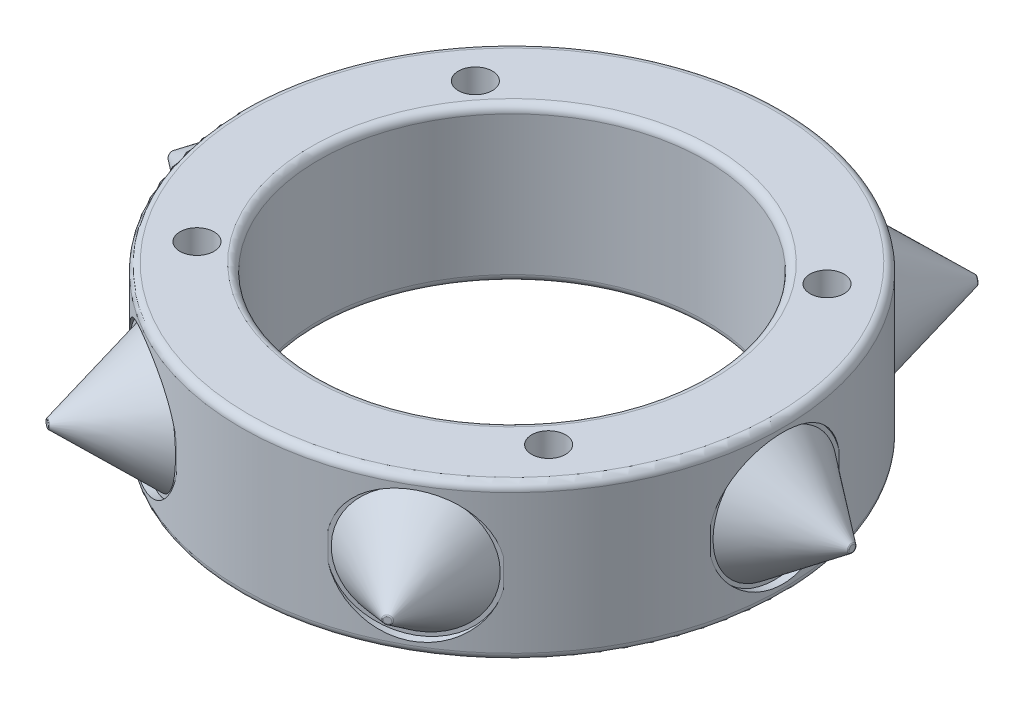
from build123d import *

# Parameters (mm, degrees)
EXTRUDE_1_DEPTH          = 5
EXTRUDE_1_DEPTH_BACK     = 5
SKETCH_1_R               = 17.5
SKETCH_1_R_2             = 12.5
FILLET_1_R               = 0.5
PATTERN_CIRCULAR_5_COUNT = 6
SKETCH_3_R               = 4.25
CUT_EXTRUDE_1_DEPTH      = 10
PATTERN_CIRCULAR_6_COUNT = 6
SKETCH_4_R               = 1.1
CUT_EXTRUDE_2_DEPTH      = 31.843700919


with BuildPart() as part:
    # ｽｹｯﾁ1 → ﾎﾞｽ - 押し出し1 (new, two sides: drawn at the far end of the back side and taken through both)
    with BuildSketch(Plane(origin=(0, 0, 0), x_dir=(1, 0, 0), z_dir=(0, 1, 0)).offset(-EXTRUDE_1_DEPTH_BACK)):
        Circle(SKETCH_1_R)
        Circle(SKETCH_1_R_2, mode=Mode.SUBTRACT)
    extrude(amount=EXTRUDE_1_DEPTH + EXTRUDE_1_DEPTH_BACK)

    # ﾌｨﾚｯﾄ1
    fillet_1_edges = [part.edges().sort_by_distance(p)[0] for p in [
        (-12.5, -5, 0),
        (-17.5, -5, 0),
        (-12.5, 5, 0),
        (-17.5, 5, 0),
    ]]
    fillet(fillet_1_edges, radius=FILLET_1_R)

    # ｽｹｯﾁ3 → ｶｯﾄ - 押し出し1 (cut)
    with BuildSketch(Plane(origin=(-8.5, 0, 14.722431864), x_dir=(-0.8660254037844434, 0, -0.49999999999999195), z_dir=(0.49999999999999195, 0, -0.8660254037844434))):
        Circle(SKETCH_3_R)
    cut_extrude_1 = extrude(amount=-CUT_EXTRUDE_1_DEPTH, mode=Mode.SUBTRACT)

    # 円形ﾊﾟﾀｰﾝ6: ｶｯﾄ - 押し出し1 ×6 about axis
    pattern_circular_6_axis = Axis((0, -4.5, 0), (0, 1, 0))
    for i in range(1, PATTERN_CIRCULAR_6_COUNT):
        add(cut_extrude_1.rotate(pattern_circular_6_axis, i * 360 / PATTERN_CIRCULAR_6_COUNT), mode=Mode.SUBTRACT)

    # ｽｹｯﾁ4 → ｶｯﾄ - 押し出し2 (cut, through all)
    with BuildSketch(Plane(origin=(0, 5, 0), x_dir=(1, 0, 0), z_dir=(0, 1, 0))):
        with Locations((11.368817001, 9)):
            Circle(SKETCH_4_R)
        with Locations((11.368817001, -9)):
            Circle(SKETCH_4_R)
        with Locations((-11.368817001, -9)):
            Circle(SKETCH_4_R)
        with Locations((-11.368817001, 9)):
            Circle(SKETCH_4_R)
    extrude(amount=-CUT_EXTRUDE_2_DEPTH, mode=Mode.SUBTRACT)


with BuildPart() as body_2:
    # ｽｹｯﾁ2 → 回転1 (revolve)
    with BuildSketch(Plane.XY):
        with BuildLine():
            ThreePointArc((22, 0.2), (21.989442719, 0.24472136), (21.96, 0.28))
            Line((21.96, 0.28), (17, 4))
            Line((17, 4), (17, 0))
            Line((17, 0), (22, 0))
            Line((22, 0), (22, 0.2))
        make_face()
    revolve(axis=Axis((22, 0, 0), (-1, 0, 0)))


with BuildPart() as pattern_circular_5_1:
    # 円形ﾊﾟﾀｰﾝ5: pattern copy
    add(body_2.part.rotate(Axis((0, -4.5, 0), (0, 1, 0)), 1 * 360 / PATTERN_CIRCULAR_5_COUNT))


with BuildPart() as pattern_circular_5_2:
    # 円形ﾊﾟﾀｰﾝ5: pattern copy
    add(body_2.part.rotate(Axis((0, -4.5, 0), (0, 1, 0)), 2 * 360 / PATTERN_CIRCULAR_5_COUNT))


with BuildPart() as pattern_circular_5_3:
    # 円形ﾊﾟﾀｰﾝ5: pattern copy
    add(body_2.part.rotate(Axis((0, -4.5, 0), (0, 1, 0)), 3 * 360 / PATTERN_CIRCULAR_5_COUNT))


with BuildPart() as pattern_circular_5_4:
    # 円形ﾊﾟﾀｰﾝ5: pattern copy
    add(body_2.part.rotate(Axis((0, -4.5, 0), (0, 1, 0)), 4 * 360 / PATTERN_CIRCULAR_5_COUNT))


with BuildPart() as pattern_circular_5_5:
    # 円形ﾊﾟﾀｰﾝ5: pattern copy
    add(body_2.part.rotate(Axis((0, -4.5, 0), (0, 1, 0)), 5 * 360 / PATTERN_CIRCULAR_5_COUNT))


solid = Compound([part.part, body_2.part, pattern_circular_5_1.part, pattern_circular_5_2.part, pattern_circular_5_3.part, pattern_circular_5_4.part, pattern_circular_5_5.part])
